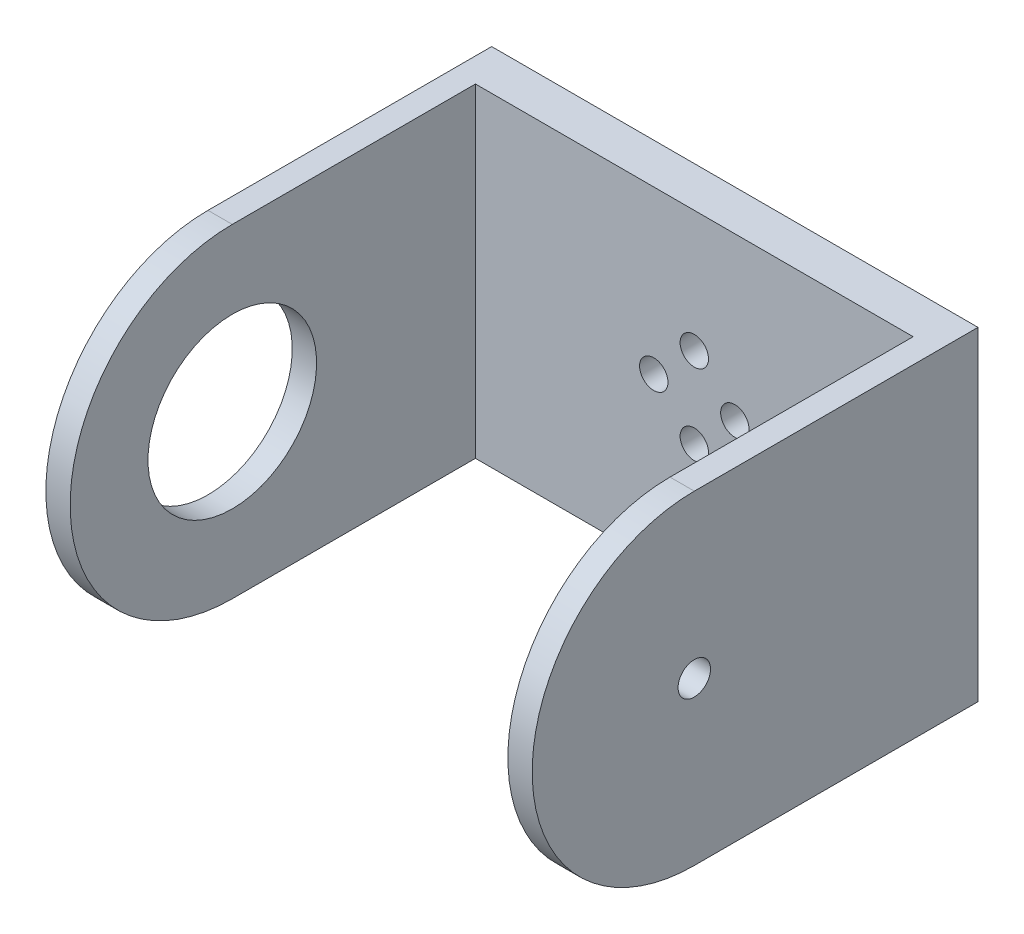
from build123d import *

# Parameters (mm, degrees)
SKETCH1_W               = 60
SKETCH1_H               = 40
BOSS_EXTRUDE1_DEPTH     = 5
SKETCH3_W               = 3
SKETCH3_H               = 40
BOSS_EXTRUDE2_DEPTH     = 30
BOSS_EXTRUDE3_DEPTH     = 3
BOSS_EXTRUDE4_START     = -3
BOSS_EXTRUDE4_DEPTH     = 3
SKETCH8_R               = 1.75
CUT_EXTRUDE1_DEPTH      = 66.76473219
CUT_EXTRUDE2_DEPTH      = 84.815273071
CUT_EXTRUDE2_DEPTH_BACK = 3
SKETCH11_R              = 10.4
SKETCH13_R              = 2
CUT_EXTRUDE3_DEPTH      = 10


with BuildPart() as part:
    # Sketch1 → Boss-Extrude1 (new body)
    with BuildSketch(Plane.XY):
        Rectangle(SKETCH1_W, SKETCH1_H)
    extrude(amount=BOSS_EXTRUDE1_DEPTH)

    # Sketch3 → Boss-Extrude2 (add)
    with BuildSketch(Plane.XY.offset(5)):
        with Locations((-28.5, 0)):
            Rectangle(SKETCH3_W, SKETCH3_H)
        with Locations((28.5, 0)):
            Rectangle(SKETCH3_W, SKETCH3_H)
    extrude(amount=BOSS_EXTRUDE2_DEPTH)

    # Sketch9 → Boss-Extrude3 (add)
    with BuildSketch(Plane(origin=(30, 0, 0), x_dir=(0, 0, -1), z_dir=(1, 0, 0))):
        with BuildLine():
            Line((-35, 20), (-35, -20))
            ThreePointArc((-35, -20), (-55, 0), (-35, 20))
        make_face()
    extrude(amount=-BOSS_EXTRUDE3_DEPTH)

    # Sketch10 → Boss-Extrude4 (add)
    with BuildSketch(Plane.ZY.offset(30).offset(BOSS_EXTRUDE4_START)):
        with BuildLine():
            Line((35, 20), (35, -20))
            ThreePointArc((35, -20), (55, 0), (35, 20))
        make_face()
    extrude(amount=BOSS_EXTRUDE4_DEPTH)

    # Sketch8 → Cut-Extrude1 (cut, through all)
    with BuildSketch(Plane(origin=(0, 0, 0), x_dir=(-1, 0, 0), z_dir=(0, 0, -1))):
        with Locations((-5, 0)):
            Circle(SKETCH8_R)
        with Locations((0, 5)):
            Circle(SKETCH8_R)
        with Locations((0, -5)):
            Circle(SKETCH8_R)
        with Locations((5, 0)):
            Circle(SKETCH8_R)
    extrude(amount=-CUT_EXTRUDE1_DEPTH, mode=Mode.SUBTRACT)

    # Sketch11 → Cut-Extrude2 (cut, two sides: drawn at the far end of the back side and taken through both)
    with BuildSketch(Plane.ZY.offset(30).offset(-CUT_EXTRUDE2_DEPTH_BACK)):
        with Locations(Location((35, 0, 0), (0, 0, 90))):
            Circle(SKETCH11_R)
    extrude(amount=CUT_EXTRUDE2_DEPTH + CUT_EXTRUDE2_DEPTH_BACK, mode=Mode.SUBTRACT)

    # Sketch13 → Cut-Extrude3 (cut)
    with BuildSketch(Plane(origin=(30, 0, 0), x_dir=(0, 0, -1), z_dir=(1, 0, 0))):
        with Locations(Location((-35, 0, 0), (0, 0, 90))):
            Circle(SKETCH13_R)
    extrude(amount=-CUT_EXTRUDE3_DEPTH, mode=Mode.SUBTRACT)


solid = part.part
